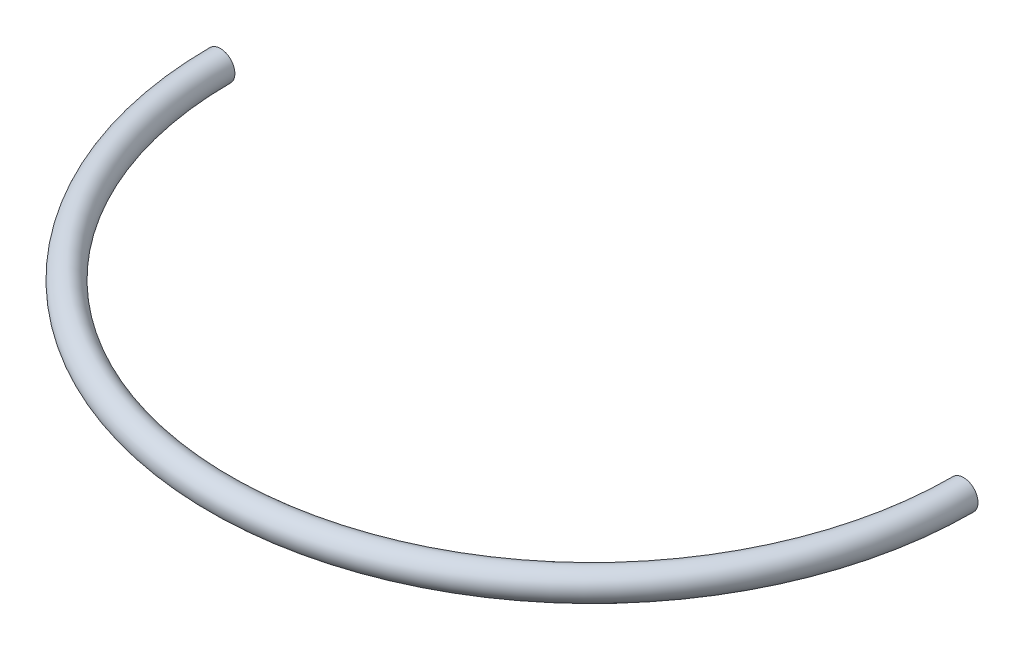
from build123d import *

# Parameters (mm, degrees)
SKETCH1_R = 2.5


with BuildPart() as part:
    # Sweep1: sweep along a path in Sketch2
    with BuildLine(Plane(origin=(0, 0, 0), x_dir=(1, 0, 0), z_dir=(0, 1, 0))) as sweep1_path:
        ThreePointArc((64, 0), (0, -64), (-64, 0))
    # Sketch1 → Sweep1 (sweep)
    with BuildSketch(Plane.XY):
        with Locations((-64, 0)):
            Circle(SKETCH1_R)
    sweep(path=sweep1_path.line)


solid = part.part
